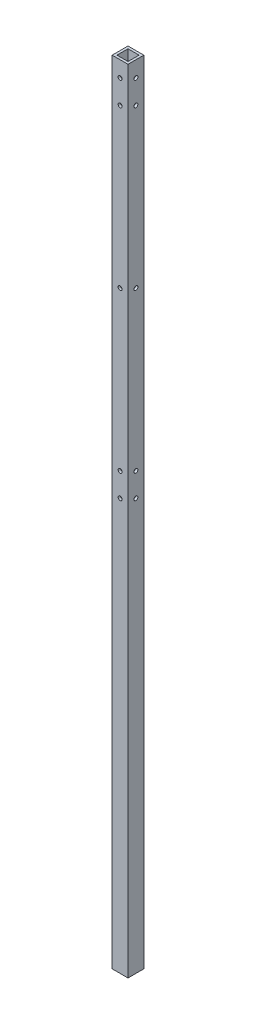
from build123d import *

# Parameters (mm, degrees)
SKETCH1_W                   = 20
SKETCH1_H                   = 20
SKETCH1_W_2                 = 14
SKETCH1_H_2                 = 14
BOSS_EXTRUDE1_DEPTH         = 1000
SKETCH3_R                   = 2.5
CUT_EXTRUDE1_DEPTH          = 10
LPATTERN1_COUNT             = 3
LPATTERN1_PITCH             = 230
CIRPATTERN1_COPY_1_SKETCH_R = 2.5
CIRPATTERN1_COPY_1_DEPTH    = 10
CIRPATTERN1_COPY_2_SKETCH_R = 2.5
CIRPATTERN1_COPY_2_DEPTH    = 10
CIRPATTERN1_COPY_3_SKETCH_R = 2.5
CIRPATTERN1_COPY_3_DEPTH    = 10
CIRPATTERN1_COPY_4_SKETCH_R = 2.5
CIRPATTERN1_COPY_4_DEPTH    = 10
CIRPATTERN1_COPY_5_SKETCH_R = 2.5
CIRPATTERN1_COPY_5_DEPTH    = 10
CIRPATTERN1_COPY_6_SKETCH_R = 2.5
CIRPATTERN1_COPY_6_DEPTH    = 10
SKETCH6_R                   = 2.5
CUT_EXTRUDE2_DEPTH          = 10
LPATTERN2_COUNT             = 2
LPATTERN2_PITCH             = 400
CIRPATTERN2_COPY_1_SKETCH_R = 2.5
CIRPATTERN2_COPY_1_DEPTH    = 10
CIRPATTERN2_COPY_2_SKETCH_R = 2.5
CIRPATTERN2_COPY_2_DEPTH    = 10
CIRPATTERN2_COPY_3_SKETCH_R = 2.5
CIRPATTERN2_COPY_3_DEPTH    = 10
CIRPATTERN2_COPY_4_SKETCH_R = 2.5
CIRPATTERN2_COPY_4_DEPTH    = 10


with BuildPart() as part:
    # Sketch1 → Boss-Extrude1 (new body)
    with BuildSketch(Plane(origin=(0, 0, 0), x_dir=(1, 0, 0), z_dir=(0, 1, 0))):
        with Locations((10, 10)):
            Rectangle(SKETCH1_W, SKETCH1_H)
        with Locations((10, 10)):
            Rectangle(SKETCH1_W_2, SKETCH1_H_2, mode=Mode.SUBTRACT)
    extrude(amount=BOSS_EXTRUDE1_DEPTH)

    # Sketch3 → Cut-Extrude1 (cut)
    with BuildSketch(Plane(origin=(20, 0, 0), x_dir=(0, 0, -1), z_dir=(1, 0, 0))):
        with Locations((10, 980)):
            Circle(SKETCH3_R)
    cut_extrude1 = extrude(amount=-CUT_EXTRUDE1_DEPTH, mode=Mode.SUBTRACT)

    # LPattern1: Cut-Extrude1 ×3
    with Locations(*[(0, -i * LPATTERN1_PITCH, 0) for i in range(1, LPATTERN1_COUNT)]):
        add(cut_extrude1, mode=Mode.SUBTRACT)

    # CirPattern1 copy 1 sketch → CirPattern1 copy 1 (cut)
    with BuildSketch(Plane(origin=(0, -230, 0), x_dir=(1, 0, 0), z_dir=(0, 0, 1))):
        with Locations((10, 980)):
            Circle(CIRPATTERN1_COPY_1_SKETCH_R)
    extrude(amount=-CIRPATTERN1_COPY_1_DEPTH, mode=Mode.SUBTRACT)

    # CirPattern1 copy 2 sketch → CirPattern1 copy 2 (cut)
    with BuildSketch(Plane(origin=(0, -230, -20), x_dir=(0, 0, 1), z_dir=(-1, 0, 0))):
        with Locations((10, 980)):
            Circle(CIRPATTERN1_COPY_2_SKETCH_R)
    extrude(amount=-CIRPATTERN1_COPY_2_DEPTH, mode=Mode.SUBTRACT)

    # CirPattern1 copy 3 sketch → CirPattern1 copy 3 (cut)
    with BuildSketch(Plane(origin=(0, -460, 0), x_dir=(1, 0, 0), z_dir=(0, 0, 1))):
        with Locations((10, 980)):
            Circle(CIRPATTERN1_COPY_3_SKETCH_R)
    extrude(amount=-CIRPATTERN1_COPY_3_DEPTH, mode=Mode.SUBTRACT)

    # CirPattern1 copy 4 sketch → CirPattern1 copy 4 (cut)
    with BuildSketch(Plane(origin=(0, -460, -20), x_dir=(0, 0, 1), z_dir=(-1, 0, 0))):
        with Locations((10, 980)):
            Circle(CIRPATTERN1_COPY_4_SKETCH_R)
    extrude(amount=-CIRPATTERN1_COPY_4_DEPTH, mode=Mode.SUBTRACT)

    # CirPattern1 copy 5 sketch → CirPattern1 copy 5 (cut)
    with BuildSketch(Plane.XY):
        with Locations((10, 980)):
            Circle(CIRPATTERN1_COPY_5_SKETCH_R)
    extrude(amount=-CIRPATTERN1_COPY_5_DEPTH, mode=Mode.SUBTRACT)

    # CirPattern1 copy 6 sketch → CirPattern1 copy 6 (cut)
    with BuildSketch(Plane(origin=(0, 0, -20), x_dir=(0, 0, 1), z_dir=(-1, 0, 0))):
        with Locations((10, 980)):
            Circle(CIRPATTERN1_COPY_6_SKETCH_R)
    extrude(amount=-CIRPATTERN1_COPY_6_DEPTH, mode=Mode.SUBTRACT)

    # Sketch6 → Cut-Extrude2 (cut)
    with BuildSketch(Plane(origin=(20, 0, 0), x_dir=(0, 0, -1), z_dir=(1, 0, 0))):
        with Locations((10, 950)):
            Circle(SKETCH6_R)
    cut_extrude2 = extrude(amount=-CUT_EXTRUDE2_DEPTH, mode=Mode.SUBTRACT)

    # LPattern2: Cut-Extrude2 ×2
    with Locations(*[(0, -i * LPATTERN2_PITCH, 0) for i in range(1, LPATTERN2_COUNT)]):
        add(cut_extrude2, mode=Mode.SUBTRACT)

    # CirPattern2 copy 1 sketch → CirPattern2 copy 1 (cut)
    with BuildSketch(Plane(origin=(0, -400, 0), x_dir=(1, 0, 0), z_dir=(0, 0, 1))):
        with Locations((10, 950)):
            Circle(CIRPATTERN2_COPY_1_SKETCH_R)
    extrude(amount=-CIRPATTERN2_COPY_1_DEPTH, mode=Mode.SUBTRACT)

    # CirPattern2 copy 2 sketch → CirPattern2 copy 2 (cut)
    with BuildSketch(Plane(origin=(0, -400, -20), x_dir=(0, 0, 1), z_dir=(-1, 0, 0))):
        with Locations((10, 950)):
            Circle(CIRPATTERN2_COPY_2_SKETCH_R)
    extrude(amount=-CIRPATTERN2_COPY_2_DEPTH, mode=Mode.SUBTRACT)

    # CirPattern2 copy 3 sketch → CirPattern2 copy 3 (cut)
    with BuildSketch(Plane.XY):
        with Locations((10, 950)):
            Circle(CIRPATTERN2_COPY_3_SKETCH_R)
    extrude(amount=-CIRPATTERN2_COPY_3_DEPTH, mode=Mode.SUBTRACT)

    # CirPattern2 copy 4 sketch → CirPattern2 copy 4 (cut)
    with BuildSketch(Plane(origin=(0, 0, -20), x_dir=(0, 0, 1), z_dir=(-1, 0, 0))):
        with Locations((10, 950)):
            Circle(CIRPATTERN2_COPY_4_SKETCH_R)
    extrude(amount=-CIRPATTERN2_COPY_4_DEPTH, mode=Mode.SUBTRACT)


solid = part.part
